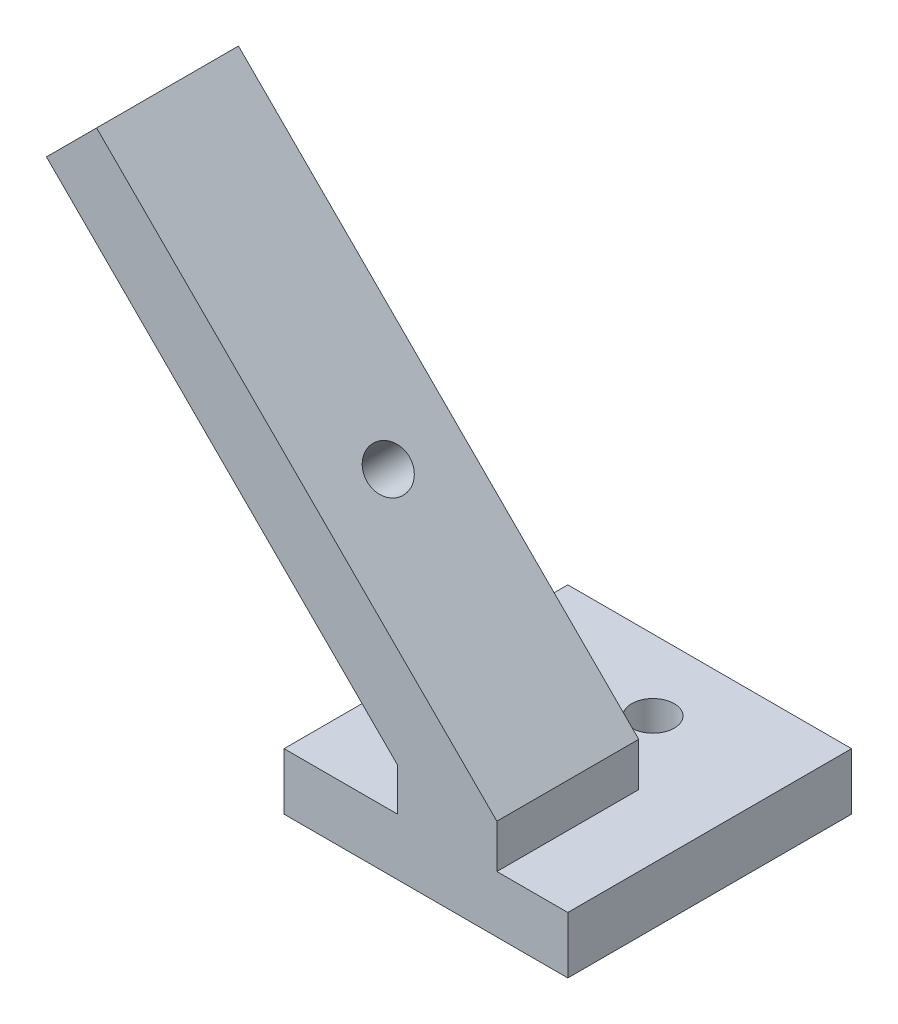
from build123d import *

# Parameters (mm, degrees)
EXTRUDE_1_DEPTH      = 10
EXTRUDE_2_DEPTH      = 10
EXTRUDE_2_DEPTH_BACK = 10
SKETCH_2_W           = 20
SKETCH_2_H           = 4
SKETCH_3_R           = 1.5
CUT_EXTRUDE_1_DEPTH  = 10
SKETCH_4_R           = 1.5
CUT_EXTRUDE_2_DEPTH  = 10


with BuildPart() as part:
    # 草图1 → 凸台-拉伸1 (new body)
    with BuildSketch(Plane.XY):
        Polygon((0, 0), (12, 0), (12, 4), (7, 4), (7, 7.071067812), (-21.213203436, 35.284271247), (-24.748737342, 31.748737342), (0, 7), align=None)
    extrude(amount=EXTRUDE_1_DEPTH)

    # 草图2 → 凸台-拉伸2 (add, two sides: drawn at the far end of the back side and taken through both)
    with BuildSketch(Plane(origin=(0, 0, 0), x_dir=(-1, 0, 0), z_dir=(0, 0, -1)).offset(-EXTRUDE_2_DEPTH_BACK)):
        with Locations((-2, 2)):
            Rectangle(SKETCH_2_W, SKETCH_2_H)
    extrude(amount=EXTRUDE_2_DEPTH + EXTRUDE_2_DEPTH_BACK)

    # 草图3 → 切除-拉伸1 (cut)
    with BuildSketch(Plane(origin=(7.035533906, 7.035533906, 0), x_dir=(0, 0, -1), z_dir=(0.7071067811865465, 0.7071067811865486, 0))):
        with Locations(Location((-5, 17.949747468, 0), (0, 0, 90))):
            Circle(SKETCH_3_R)
    extrude(amount=-CUT_EXTRUDE_1_DEPTH, mode=Mode.SUBTRACT)

    # 草图4 → 切除-拉伸2 (cut)
    with BuildSketch(Plane(origin=(0, 4, 0), x_dir=(1, 0, 0), z_dir=(0, 1, 0))):
        with Locations(Location((-5, 5, 0), (0, 0, 180))):
            Circle(SKETCH_4_R)
        with Locations(Location((3, 5, 0), (0, 0, 180))):
            Circle(SKETCH_4_R)
    extrude(amount=-CUT_EXTRUDE_2_DEPTH, mode=Mode.SUBTRACT)


solid = part.part
